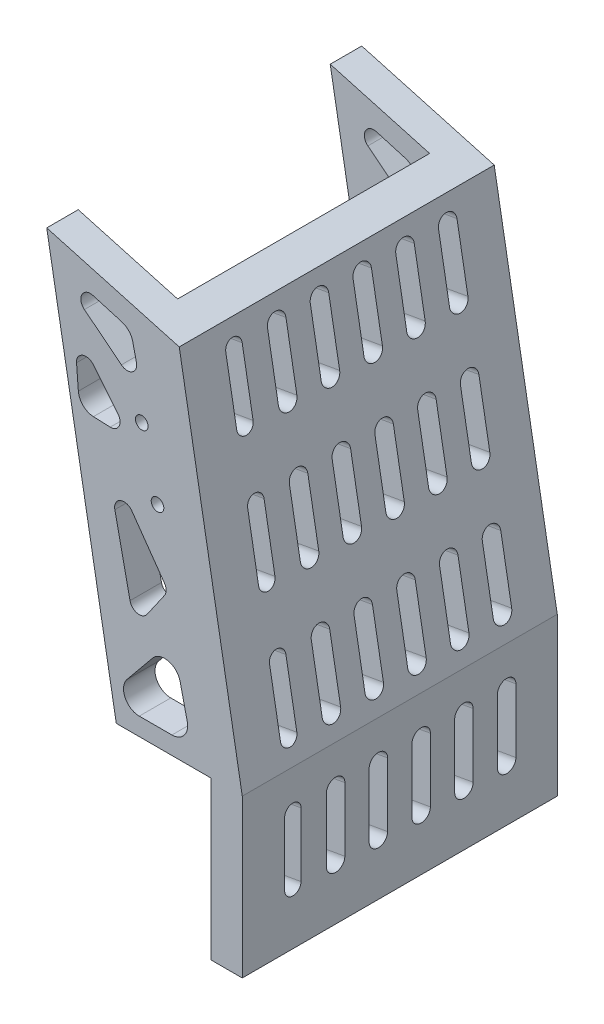
from build123d import *

# Parameters (mm, degrees)
SKETCH3_R           = 2
BOSS_EXTRUDE4_DEPTH = 50
SKETCH3_5_R         = 2
CUT_EXTRUDE4_DEPTH  = 40
CUT_EXTRUDE5_DEPTH  = 40
SKETCH5_W           = 145.844421161
SKETCH5_H           = 52.513539534
CUT_EXTRUDE6_DEPTH  = 172.166547927


with BuildPart() as part:
    # Sketch3 → Boss-Extrude4 (new, symmetric)
    with BuildSketch(Plane.XY):
        Polygon((129.986695235, 143.501091462), (87.924386026, 155.197028189), (110, 30), (110, -20), (150, -20), (150, 30), align=None)
        with Locations((123.092164461, 96.712818196)):
            Circle(SKETCH3_R, mode=Mode.SUBTRACT)
        with BuildLine():
            ThreePointArc((121.524854472, 53.707059038), (126.534279178, 55.408949396), (130.267490841, 51.660096591))
            Line((130.267490841, 51.660096591), (132.540081677, 41.767642362))
            ThreePointArc((132.540081677, 41.767642362), (131.578375882, 37.533466843), (127.667018204, 35.648154807))
            Line((127.667018204, 35.648154807), (117.299487034, 35.648154807))
            ThreePointArc((117.299487034, 35.648154807), (112.781066402, 38.507156209), (113.429914138, 43.814604808))
            Line((113.429914138, 43.814604808), (121.524854472, 53.707059038))
        make_face(mode=Mode.SUBTRACT)
        with BuildLine():
            ThreePointArc((109.548472999, 88.545666653), (111.280367865, 91.919087045), (114.933200504, 90.901128951))
            Line((114.933200504, 90.901128951), (125.27824291, 76.252390619))
            ThreePointArc((125.27824291, 76.252390619), (125.827687853, 74.534396558), (125.292677894, 72.811852601))
            Line((125.292677894, 72.811852601), (119.764450671, 64.842718875))
            ThreePointArc((119.764450671, 64.842718875), (116.708392496, 63.611484794), (114.365288182, 65.927794596))
            Line((114.365288182, 65.927794596), (109.548472999, 88.545666653))
        make_face(mode=Mode.SUBTRACT)
        with BuildLine():
            ThreePointArc((97.386050741, 122.84734261), (99.264833754, 125.86158027), (102.703067644, 124.970512375))
            Line((102.703067644, 124.970512375), (110.520532278, 115.376351234))
            ThreePointArc((110.520532278, 115.376351234), (110.877188268, 112.137851918), (108.070124306, 110.483925308))
            Line((108.070124306, 110.483925308), (102.737760276, 110.70577101))
            ThreePointArc((102.737760276, 110.70577101), (99.471655058, 112.10537994), (97.960078724, 115.321197945))
            Line((97.960078724, 115.321197945), (97.386050741, 122.84734261))
        make_face(mode=Mode.SUBTRACT)
        with Locations((118.092164461, 116.712818196)):
            Circle(SKETCH3_R, mode=Mode.SUBTRACT)
        with BuildLine():
            ThreePointArc((99.885471254, 138.726023633), (99.089432977, 142.453461875), (102.593280466, 143.953637048))
            Line((102.593280466, 143.953637048), (111.746800271, 141.283860438))
            ThreePointArc((111.746800271, 141.283860438), (113.983333551, 139.915423595), (115.219863744, 137.603347993))
            Line((115.219863744, 137.603347993), (116.41347047, 132.407648126))
            ThreePointArc((116.41347047, 132.407648126), (115.08896079, 129.197816776), (111.621823173, 129.388342179))
            Line((111.621823173, 129.388342179), (99.885471254, 138.726023633))
        make_face(mode=Mode.SUBTRACT)
        with BuildLine():
            Line((121.577082181, 22.385772775), (135.706531678, 10.823722754))
            ThreePointArc((135.706531678, 10.823722754), (136.894825472, 4.497280614), (130.865407989, 2.242943215))
            Line((130.865407989, 2.242943215), (116.735958492, 7.265481832))
            ThreePointArc((116.735958492, 7.265481832), (114.325698371, 9.093406356), (113.41063218, 11.976688475))
            Line((113.41063218, 11.976688475), (113.41063218, 18.51619988))
            ThreePointArc((113.41063218, 18.51619988), (116.269633582, 23.034620511), (121.577082181, 22.385772775))
        make_face(mode=Mode.SUBTRACT)
    extrude(amount=BOSS_EXTRUDE4_DEPTH, both=True)

    # Sketch3<5> → Cut-Extrude4 (cut, symmetric)
    with BuildSketch(Plane.XY):
        Polygon((140, 30), (119.471117933, 146.425075644), (87.924386026, 155.197028189), (110, 30), (110, -20), (140, -20), align=None)
        with BuildLine():
            ThreePointArc((121.524854472, 53.707059038), (126.534279178, 55.408949396), (130.267490841, 51.660096591))
            Line((130.267490841, 51.660096591), (132.540081677, 41.767642362))
            ThreePointArc((132.540081677, 41.767642362), (131.578375882, 37.533466843), (127.667018204, 35.648154807))
            Line((127.667018204, 35.648154807), (117.299487034, 35.648154807))
            ThreePointArc((117.299487034, 35.648154807), (112.781066402, 38.507156209), (113.429914138, 43.814604808))
            Line((113.429914138, 43.814604808), (121.524854472, 53.707059038))
        make_face(mode=Mode.SUBTRACT)
        with BuildLine():
            ThreePointArc((109.548472999, 88.545666653), (111.280367865, 91.919087045), (114.933200504, 90.901128951))
            Line((114.933200504, 90.901128951), (125.27824291, 76.252390619))
            ThreePointArc((125.27824291, 76.252390619), (125.827687853, 74.534396558), (125.292677894, 72.811852601))
            Line((125.292677894, 72.811852601), (119.764450671, 64.842718875))
            ThreePointArc((119.764450671, 64.842718875), (116.708392496, 63.611484794), (114.365288182, 65.927794596))
            Line((114.365288182, 65.927794596), (109.548472999, 88.545666653))
        make_face(mode=Mode.SUBTRACT)
        with BuildLine():
            ThreePointArc((97.386050741, 122.84734261), (99.264833754, 125.86158027), (102.703067644, 124.970512375))
            Line((102.703067644, 124.970512375), (110.520532278, 115.376351234))
            ThreePointArc((110.520532278, 115.376351234), (110.877188268, 112.137851918), (108.070124306, 110.483925308))
            Line((108.070124306, 110.483925308), (102.737760276, 110.70577101))
            ThreePointArc((102.737760276, 110.70577101), (99.471655058, 112.10537994), (97.960078724, 115.321197945))
            Line((97.960078724, 115.321197945), (97.386050741, 122.84734261))
        make_face(mode=Mode.SUBTRACT)
        with Locations((118.092164461, 116.712818196)):
            Circle(SKETCH3_5_R, mode=Mode.SUBTRACT)
        with BuildLine():
            ThreePointArc((99.885471254, 138.726023633), (99.089432977, 142.453461875), (102.593280466, 143.953637048))
            Line((102.593280466, 143.953637048), (111.746800271, 141.283860438))
            ThreePointArc((111.746800271, 141.283860438), (113.983333551, 139.915423595), (115.219863744, 137.603347993))
            Line((115.219863744, 137.603347993), (116.41347047, 132.407648126))
            ThreePointArc((116.41347047, 132.407648126), (115.08896079, 129.197816776), (111.621823173, 129.388342179))
            Line((111.621823173, 129.388342179), (99.885471254, 138.726023633))
        make_face(mode=Mode.SUBTRACT)
        with Locations((123.092164461, 96.712818196)):
            Circle(SKETCH3_5_R, mode=Mode.SUBTRACT)
        with BuildLine():
            Line((121.577082181, 22.385772775), (135.706531678, 10.823722754))
            ThreePointArc((135.706531678, 10.823722754), (136.894825472, 4.497280614), (130.865407989, 2.242943215))
            Line((130.865407989, 2.242943215), (116.735958492, 7.265481832))
            ThreePointArc((116.735958492, 7.265481832), (114.325698371, 9.093406356), (113.41063218, 11.976688475))
            Line((113.41063218, 11.976688475), (113.41063218, 18.51619988))
            ThreePointArc((113.41063218, 18.51619988), (116.269633582, 23.034620511), (121.577082181, 22.385772775))
        make_face(mode=Mode.SUBTRACT)
    extrude(amount=CUT_EXTRUDE4_DEPTH, both=True, mode=Mode.SUBTRACT)

    # Sketch4 → Cut-Extrude5 (cut, symmetric)
    with BuildSketch(Plane(origin=(150.607248709, 26.556121438, 0), x_dir=(0, 0, -1), z_dir=(0.9848077530122075, 0.17364817766693472, 0))):
        with BuildLine():
            Line((-31.340617916, 111.127437118), (-31.340617916, 91.183676744))
            ThreePointArc((-31.340617916, 91.183676744), (-33.940181926, 88.584112734), (-36.539745936, 91.183676744))
            Line((-36.539745936, 91.183676744), (-36.539745936, 111.127437118))
            ThreePointArc((-36.539745936, 111.127437118), (-33.940181926, 113.727001128), (-31.340617916, 111.127437118))
        make_face()
        with BuildLine():
            Line((-17.439599645, 111.127437118), (-17.439599645, 91.183676744))
            ThreePointArc((-17.439599645, 91.183676744), (-20.364109156, 88.259167233), (-23.288618667, 91.183676744))
            Line((-23.288618667, 91.183676744), (-23.288618667, 111.127437118))
            ThreePointArc((-23.288618667, 111.127437118), (-20.364109156, 114.051946629), (-17.439599645, 111.127437118))
        make_face()
        with BuildLine():
            Line((-3.863526874, 111.127437118), (-3.863526874, 91.183676744))
            ThreePointArc((-3.863526874, 91.183676744), (-6.788036385, 88.259167233), (-9.712545896, 91.183676744))
            Line((-9.712545896, 91.183676744), (-9.712545896, 111.127437118))
            ThreePointArc((-9.712545896, 111.127437118), (-6.788036385, 114.051946629), (-3.863526874, 111.127437118))
        make_face()
        with BuildLine():
            Line((9.712545896, 111.127437118), (9.712545896, 91.183676744))
            ThreePointArc((9.712545896, 91.183676744), (6.788036385, 88.259167233), (3.863526874, 91.183676744))
            Line((3.863526874, 91.183676744), (3.863526874, 111.127437118))
            ThreePointArc((3.863526874, 111.127437118), (6.788036385, 114.051946629), (9.712545896, 111.127437118))
        make_face()
        with BuildLine():
            Line((23.288618667, 111.127437118), (23.288618667, 91.183676744))
            ThreePointArc((23.288618667, 91.183676744), (20.364109156, 88.259167233), (17.439599645, 91.183676744))
            Line((17.439599645, 91.183676744), (17.439599645, 111.127437118))
            ThreePointArc((17.439599645, 111.127437118), (20.364109156, 114.051946629), (23.288618667, 111.127437118))
        make_face()
        with BuildLine():
            Line((36.864691437, 111.127437118), (36.864691437, 91.183676744))
            ThreePointArc((36.864691437, 91.183676744), (33.940181926, 88.259167233), (31.015672415, 91.183676744))
            Line((31.015672415, 91.183676744), (31.015672415, 111.127437118))
            ThreePointArc((31.015672415, 111.127437118), (33.940181926, 114.051946629), (36.864691437, 111.127437118))
        make_face()
        with BuildLine():
            Line((-36.539745936, 71.127437118), (-36.539745936, 51.183676744))
            ThreePointArc((-36.539745936, 51.183676744), (-33.940181926, 48.584112734), (-31.340617916, 51.183676744))
            Line((-31.340617916, 51.183676744), (-31.340617916, 71.127437118))
            ThreePointArc((-31.340617916, 71.127437118), (-33.940181926, 73.727001128), (-36.539745936, 71.127437118))
        make_face()
        with BuildLine():
            Line((-23.288618667, 71.127437118), (-23.288618667, 51.183676744))
            ThreePointArc((-23.288618667, 51.183676744), (-20.364109156, 48.259167233), (-17.439599645, 51.183676744))
            Line((-17.439599645, 51.183676744), (-17.439599645, 71.127437118))
            ThreePointArc((-17.439599645, 71.127437118), (-20.364109156, 74.051946629), (-23.288618667, 71.127437118))
        make_face()
        with BuildLine():
            Line((-3.863526874, 71.127437118), (-3.863526874, 51.183676744))
            ThreePointArc((-3.863526874, 51.183676744), (-6.788036385, 48.259167233), (-9.712545896, 51.183676744))
            Line((-9.712545896, 51.183676744), (-9.712545896, 71.127437118))
            ThreePointArc((-9.712545896, 71.127437118), (-6.788036385, 74.051946629), (-3.863526874, 71.127437118))
        make_face()
        with BuildLine():
            Line((9.712545896, 71.127437118), (9.712545896, 51.183676744))
            ThreePointArc((9.712545896, 51.183676744), (6.788036385, 48.259167233), (3.863526874, 51.183676744))
            Line((3.863526874, 51.183676744), (3.863526874, 71.127437118))
            ThreePointArc((3.863526874, 71.127437118), (6.788036385, 74.051946629), (9.712545896, 71.127437118))
        make_face()
        with BuildLine():
            Line((23.288618667, 71.127437118), (23.288618667, 51.183676744))
            ThreePointArc((23.288618667, 51.183676744), (20.364109156, 48.259167233), (17.439599645, 51.183676744))
            Line((17.439599645, 51.183676744), (17.439599645, 71.127437118))
            ThreePointArc((17.439599645, 71.127437118), (20.364109156, 74.051946629), (23.288618667, 71.127437118))
        make_face()
        with BuildLine():
            Line((36.864691437, 71.127437118), (36.864691437, 51.183676744))
            ThreePointArc((36.864691437, 51.183676744), (33.940181926, 48.259167233), (31.015672415, 51.183676744))
            Line((31.015672415, 51.183676744), (31.015672415, 71.127437118))
            ThreePointArc((31.015672415, 71.127437118), (33.940181926, 74.051946629), (36.864691437, 71.127437118))
        make_face()
        with BuildLine():
            Line((-36.539745936, 31.127437118), (-36.539745936, 11.183676744))
            ThreePointArc((-36.539745936, 11.183676744), (-33.940181926, 8.584112734), (-31.340617916, 11.183676744))
            Line((-31.340617916, 11.183676744), (-31.340617916, 31.127437118))
            ThreePointArc((-31.340617916, 31.127437118), (-33.940181926, 33.727001128), (-36.539745936, 31.127437118))
        make_face()
        with BuildLine():
            Line((-23.288618667, 31.127437118), (-23.288618667, 11.183676744))
            ThreePointArc((-23.288618667, 11.183676744), (-20.364109156, 8.259167233), (-17.439599645, 11.183676744))
            Line((-17.439599645, 11.183676744), (-17.439599645, 31.127437118))
            ThreePointArc((-17.439599645, 31.127437118), (-20.364109156, 34.051946629), (-23.288618667, 31.127437118))
        make_face()
        with BuildLine():
            Line((-3.863526874, 31.127437118), (-3.863526874, 11.183676744))
            ThreePointArc((-3.863526874, 11.183676744), (-6.788036385, 8.259167233), (-9.712545896, 11.183676744))
            Line((-9.712545896, 11.183676744), (-9.712545896, 31.127437118))
            ThreePointArc((-9.712545896, 31.127437118), (-6.788036385, 34.051946629), (-3.863526874, 31.127437118))
        make_face()
        with BuildLine():
            Line((9.712545896, 31.127437118), (9.712545896, 11.183676744))
            ThreePointArc((9.712545896, 11.183676744), (6.788036385, 8.259167233), (3.863526874, 11.183676744))
            Line((3.863526874, 11.183676744), (3.863526874, 31.127437118))
            ThreePointArc((3.863526874, 31.127437118), (6.788036385, 34.051946629), (9.712545896, 31.127437118))
        make_face()
        with BuildLine():
            Line((23.288618667, 31.127437118), (23.288618667, 11.183676744))
            ThreePointArc((23.288618667, 11.183676744), (20.364109156, 8.259167233), (17.439599645, 11.183676744))
            Line((17.439599645, 11.183676744), (17.439599645, 31.127437118))
            ThreePointArc((17.439599645, 31.127437118), (20.364109156, 34.051946629), (23.288618667, 31.127437118))
        make_face()
        with BuildLine():
            Line((36.864691437, 31.127437118), (36.864691437, 11.183676744))
            ThreePointArc((36.864691437, 11.183676744), (33.940181926, 8.259167233), (31.015672415, 11.183676744))
            Line((31.015672415, 11.183676744), (31.015672415, 31.127437118))
            ThreePointArc((31.015672415, 31.127437118), (33.940181926, 34.051946629), (36.864691437, 31.127437118))
        make_face()
        with BuildLine():
            Line((-36.539745936, -8.872562882), (-36.539745936, -28.816323256))
            ThreePointArc((-36.539745936, -28.816323256), (-33.940181926, -31.415887266), (-31.340617916, -28.816323256))
            Line((-31.340617916, -28.816323256), (-31.340617916, -8.872562882))
            ThreePointArc((-31.340617916, -8.872562882), (-33.940181926, -6.272998872), (-36.539745936, -8.872562882))
        make_face()
        with BuildLine():
            Line((-23.288618667, -8.872562882), (-23.288618667, -28.816323256))
            ThreePointArc((-23.288618667, -28.816323256), (-20.364109156, -31.740832767), (-17.439599645, -28.816323256))
            Line((-17.439599645, -28.816323256), (-17.439599645, -8.872562882))
            ThreePointArc((-17.439599645, -8.872562882), (-20.364109156, -5.948053371), (-23.288618667, -8.872562882))
        make_face()
        with BuildLine():
            Line((-3.863526874, -8.872562882), (-3.863526874, -28.816323256))
            ThreePointArc((-3.863526874, -28.816323256), (-6.788036385, -31.740832767), (-9.712545896, -28.816323256))
            Line((-9.712545896, -28.816323256), (-9.712545896, -8.872562882))
            ThreePointArc((-9.712545896, -8.872562882), (-6.788036385, -5.948053371), (-3.863526874, -8.872562882))
        make_face()
        with BuildLine():
            Line((9.712545896, -8.872562882), (9.712545896, -28.816323256))
            ThreePointArc((9.712545896, -28.816323256), (6.788036385, -31.740832767), (3.863526874, -28.816323256))
            Line((3.863526874, -28.816323256), (3.863526874, -8.872562882))
            ThreePointArc((3.863526874, -8.872562882), (6.788036385, -5.948053371), (9.712545896, -8.872562882))
        make_face()
        with BuildLine():
            Line((23.288618667, -8.872562882), (23.288618667, -28.816323256))
            ThreePointArc((23.288618667, -28.816323256), (20.364109156, -31.740832767), (17.439599645, -28.816323256))
            Line((17.439599645, -28.816323256), (17.439599645, -8.872562882))
            ThreePointArc((17.439599645, -8.872562882), (20.364109156, -5.948053371), (23.288618667, -8.872562882))
        make_face()
        with BuildLine():
            Line((36.864691437, -8.872562882), (36.864691437, -28.816323256))
            ThreePointArc((36.864691437, -28.816323256), (33.940181926, -31.740832767), (31.015672415, -28.816323256))
            Line((31.015672415, -28.816323256), (31.015672415, -8.872562882))
            ThreePointArc((31.015672415, -8.872562882), (33.940181926, -5.948053371), (36.864691437, -8.872562882))
        make_face()
    extrude(amount=CUT_EXTRUDE5_DEPTH, both=True, mode=Mode.SUBTRACT)

    # Sketch5 → Cut-Extrude6 (cut, through all)
    with BuildSketch(Plane.ZY.offset(-140)):
        with Locations((-9.667265233, 3.746823979)):
            Rectangle(SKETCH5_W, SKETCH5_H)
    extrude(amount=CUT_EXTRUDE6_DEPTH, mode=Mode.SUBTRACT)


solid = part.part
